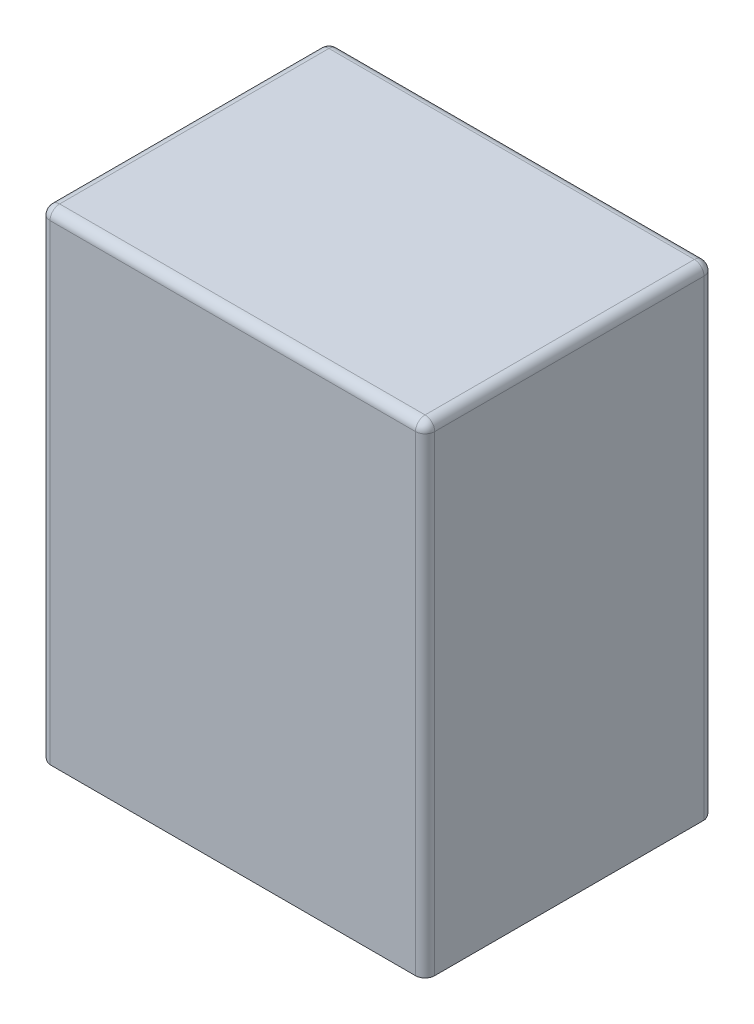
from build123d import *

# Parameters (mm, degrees)
SKETCH_1_W      = 400
SKETCH_1_H      = 300
EXTRUDE_1_DEPTH = 500
FILLET_1_R      = 10


with BuildPart() as part:
    # 草图1 → 凸台-拉伸1 (new body)
    with BuildSketch(Plane(origin=(0, 0, 0), x_dir=(1, 0, 0), z_dir=(0, 1, 0))):
        Rectangle(SKETCH_1_W, SKETCH_1_H)
    extrude(amount=EXTRUDE_1_DEPTH)

    # 圆角1
    fillet_1_edges = [part.edges().sort_by_distance(p)[0] for p in [
        (200, 500, 0),
        (0, 500, -150),
        (-200, 500, 0),
        (0, 0, -150),
        (-200, 0, 0),
        (0, 500, 150),
        (-200, 250, -150),
        (200, 250, -150),
        (200, 250, 150),
        (-200, 250, 150),
    ]]
    fillet(fillet_1_edges, radius=FILLET_1_R)


solid = part.part
